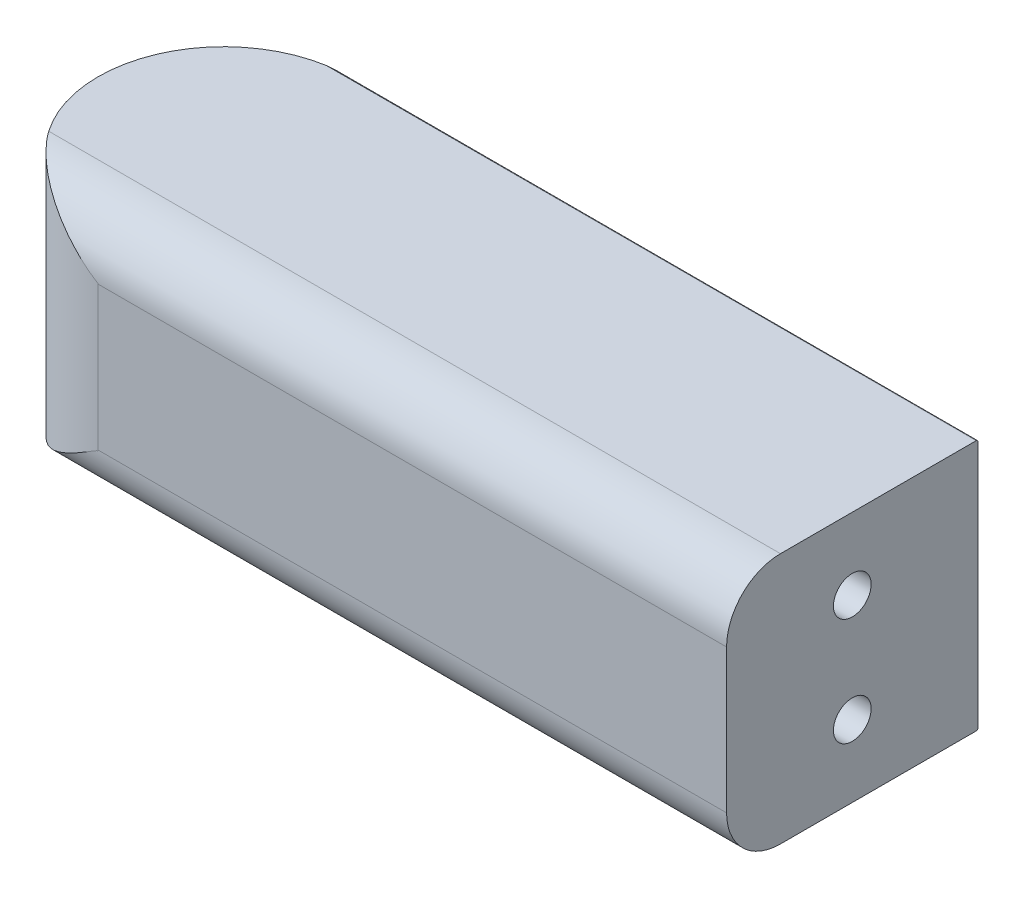
from build123d import *

# Parameters (mm, degrees)
SKETCH1_R           = 69.995
SKETCH1_W           = 350
SKETCH1_H           = 140
BOSS_EXTRUDE1_DEPTH = 140
SKETCH2_R           = 10.5
CUT_EXTRUDE3_DEPTH  = 41
FILLET2_R           = 30
FILLET3_R           = 1
CUT_EXTRUDE4_START  = -41
SKETCH3_R           = 10.5
CUT_EXTRUDE4_DEPTH  = 41


with BuildPart() as part:
    # Sketch1 → Boss-Extrude1 (new body)
    with BuildSketch(Plane(origin=(0, 0, 0), x_dir=(1, 0, 0), z_dir=(0, 1, 0))):
        with Locations((0, -70)):
            Circle(SKETCH1_R)
        with Locations((175, -70)):
            Rectangle(SKETCH1_W, SKETCH1_H)
    extrude(amount=BOSS_EXTRUDE1_DEPTH)

    # Sketch2 → Cut-Extrude3 (cut)
    with BuildSketch(Plane(origin=(-70, 0, 0), x_dir=(0, 0, -1), z_dir=(1, 0, 0))):
        with Locations(Location((-70, 100, 0), (0, 0, 180))):
            Circle(SKETCH2_R)
        with Locations(Location((-70, 40, 0), (0, 0, 180))):
            Circle(SKETCH2_R)
    extrude(amount=CUT_EXTRUDE3_DEPTH, mode=Mode.SUBTRACT)

    # Fillet2
    fillet2_edges = [part.edges().sort_by_distance(p)[0] for p in [
        (175, 140, 140),
        (175, 0, 140),
    ]]
    fillet(fillet2_edges, radius=FILLET2_R)

    # Fillet3
    fillet3_edges = [part.edges().sort_by_distance(p)[0] for p in [
        (175, 140, 0),
        (175, 0, 0),
    ]]
    fillet(fillet3_edges, radius=FILLET3_R)

    # Sketch3 → Cut-Extrude4 (cut)
    with BuildSketch(Plane(origin=(350, 0, 0), x_dir=(0, 0, -1), z_dir=(1, 0, 0)).offset(CUT_EXTRUDE4_START)):
        with Locations(Location((-70, 100, 0), (0, 0, 180))):
            Circle(SKETCH3_R)
        with Locations(Location((-70, 40, 0), (0, 0, 180))):
            Circle(SKETCH3_R)
    extrude(amount=CUT_EXTRUDE4_DEPTH, mode=Mode.SUBTRACT)


solid = part.part
